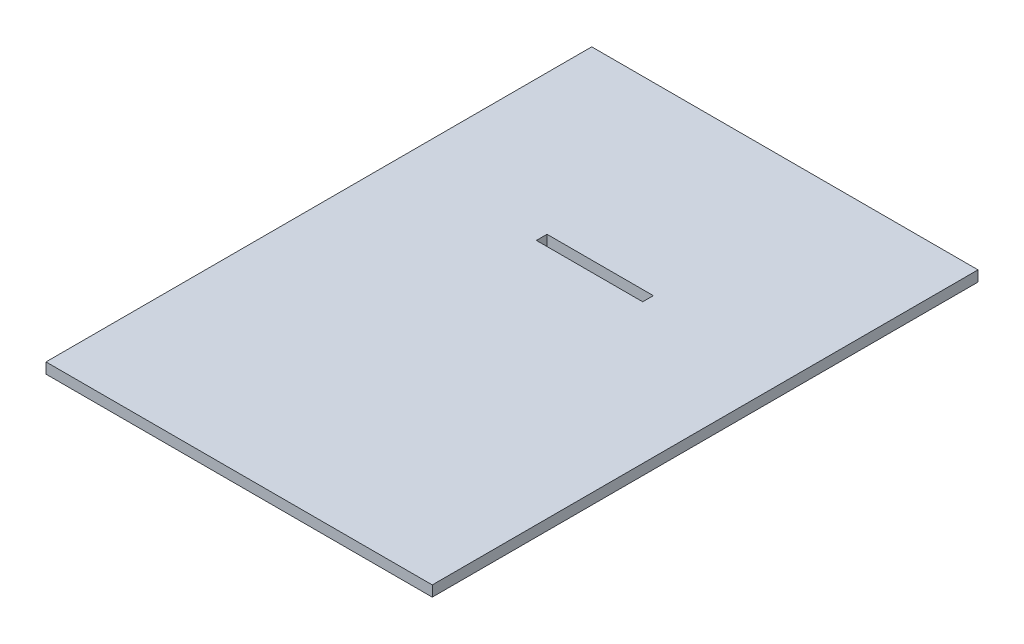
from build123d import *

# Parameters (mm, degrees)
SKETCH1_W           = 109
SKETCH1_H           = 154
BOSS_EXTRUDE1_DEPTH = 3
SKETCH2_W           = 30
SKETCH2_H           = 3
CUT_EXTRUDE1_DEPTH  = 3


with BuildPart() as part:
    # Sketch1 → Boss-Extrude1 (new body)
    with BuildSketch(Plane(origin=(0, 0, 0), x_dir=(1, 0, 0), z_dir=(0, 1, 0))):
        with Locations((54.5, 77)):
            Rectangle(SKETCH1_W, SKETCH1_H)
    extrude(amount=BOSS_EXTRUDE1_DEPTH)

    # Sketch2 → Cut-Extrude1 (cut)
    with BuildSketch(Plane(origin=(0, 3, 0), x_dir=(1, 0, 0), z_dir=(0, 1, 0))):
        with Locations((54.5, 100.38)):
            Rectangle(SKETCH2_W, SKETCH2_H)
    extrude(amount=-CUT_EXTRUDE1_DEPTH, mode=Mode.SUBTRACT)


solid = part.part
